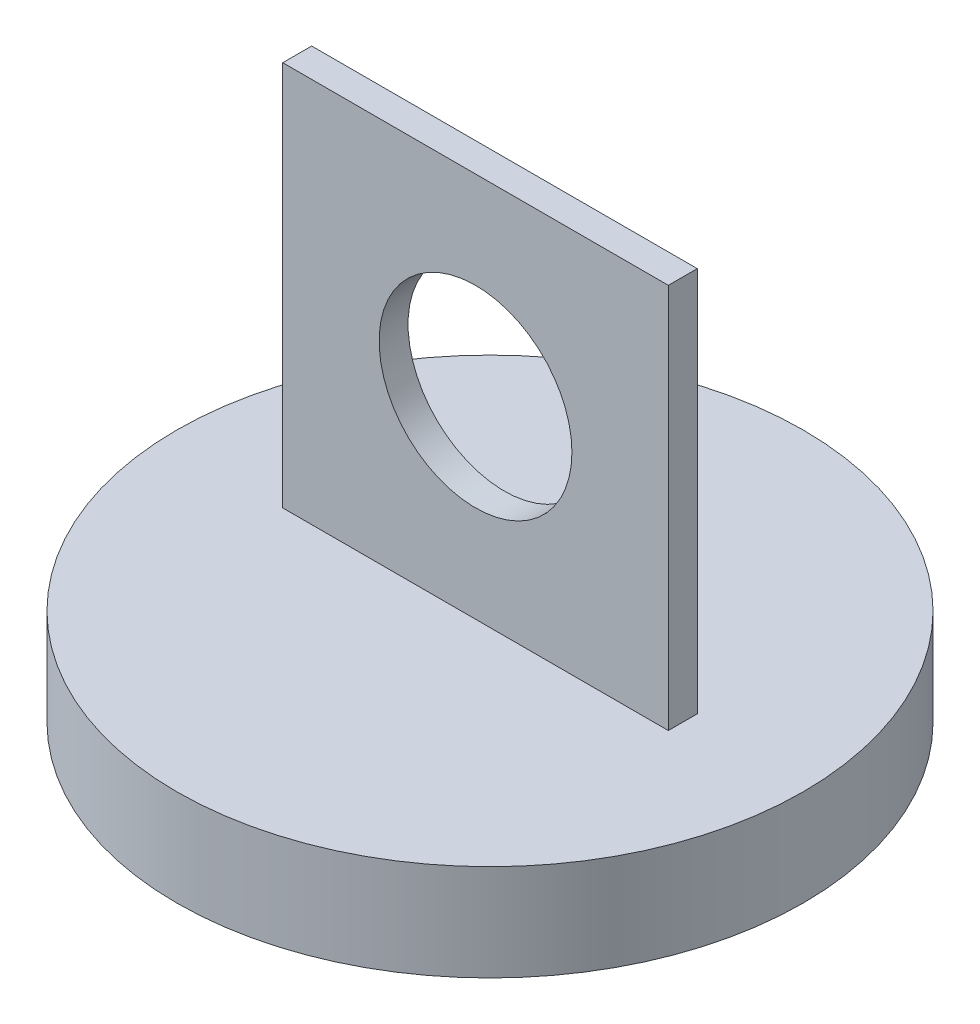
from build123d import *

# Parameters (mm, degrees)
SKETCH1_R           = 32.5
BOSS_EXTRUDE1_DEPTH = 10
SKETCH4_W           = 40
SKETCH4_H           = 3
BOSS_EXTRUDE3_DEPTH = 40
SKETCH5_R           = 10
CUT_EXTRUDE2_DEPTH  = 40


with BuildPart() as part:
    # Sketch1 → Boss-Extrude1 (new body)
    with BuildSketch(Plane(origin=(0, 0, 0), x_dir=(1, 0, 0), z_dir=(0, 1, 0))):
        with Locations(Location((0, 0, 0), (0, 0, 270))):
            Circle(SKETCH1_R)
    extrude(amount=BOSS_EXTRUDE1_DEPTH)

    # Sketch4 → Boss-Extrude3 (add)
    with BuildSketch(Plane(origin=(0, 10, 0), x_dir=(1, 0, 0), z_dir=(0, 1, 0))):
        Rectangle(SKETCH4_W, SKETCH4_H)
    extrude(amount=BOSS_EXTRUDE3_DEPTH)

    # Sketch5 → Cut-Extrude2 (cut)
    with BuildSketch(Plane.XY.offset(1.5)):
        with Locations((0, 30)):
            Circle(SKETCH5_R)
    extrude(amount=-CUT_EXTRUDE2_DEPTH, mode=Mode.SUBTRACT)


solid = part.part
